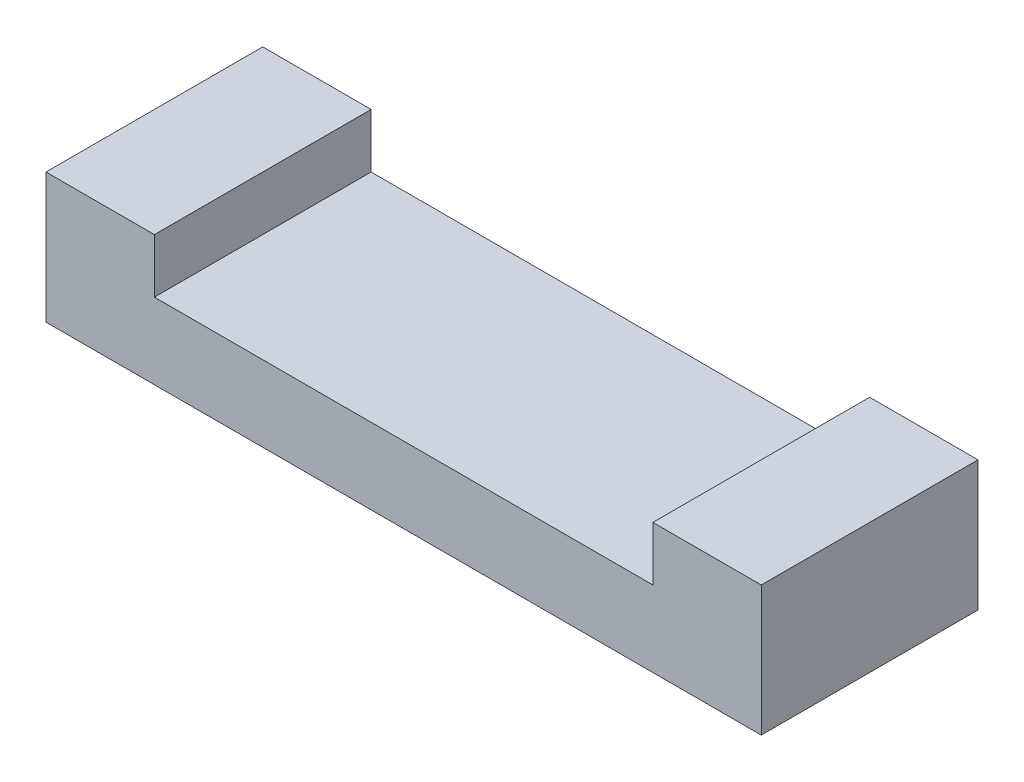
from build123d import *

# Parameters (mm, degrees)
EXTRUDE1_DEPTH = 10


with BuildPart() as part:
    # Sketch1 → Extrude1 (new body)
    with BuildSketch(Plane.XY):
        Polygon((-17.007352941, 2.5), (-12.007352941, 2.5), (-12.007352941, 0), (10.992647059, 0), (10.992647059, 2.5), (15.992647059, 2.5), (15.992647059, -3.5), (-17.007352941, -3.5), align=None)
    extrude(amount=EXTRUDE1_DEPTH)


solid = part.part
